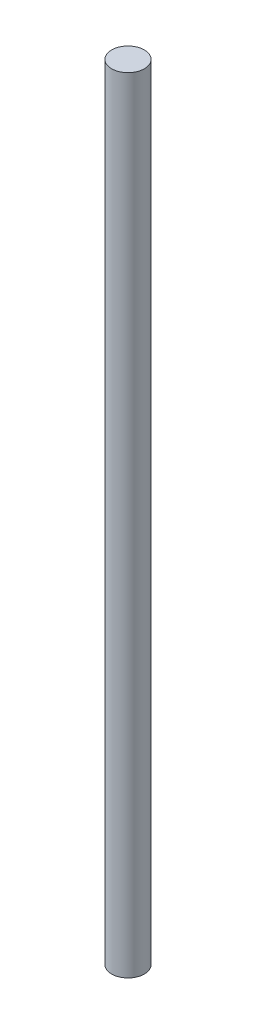
from build123d import *

# Parameters (mm, degrees)
SKETCH1_R           = 6.35
BOSS_EXTRUDE1_DEPTH = 304.8


with BuildPart() as part:
    # Sketch1 → Boss-Extrude1 (new body)
    with BuildSketch(Plane(origin=(0, 0, 0), x_dir=(1, 0, 0), z_dir=(0, 1, 0))):
        with Locations(Location((0, 0, 0), (0, 0, 90))):
            Circle(SKETCH1_R)
    extrude(amount=BOSS_EXTRUDE1_DEPTH)


solid = part.part
